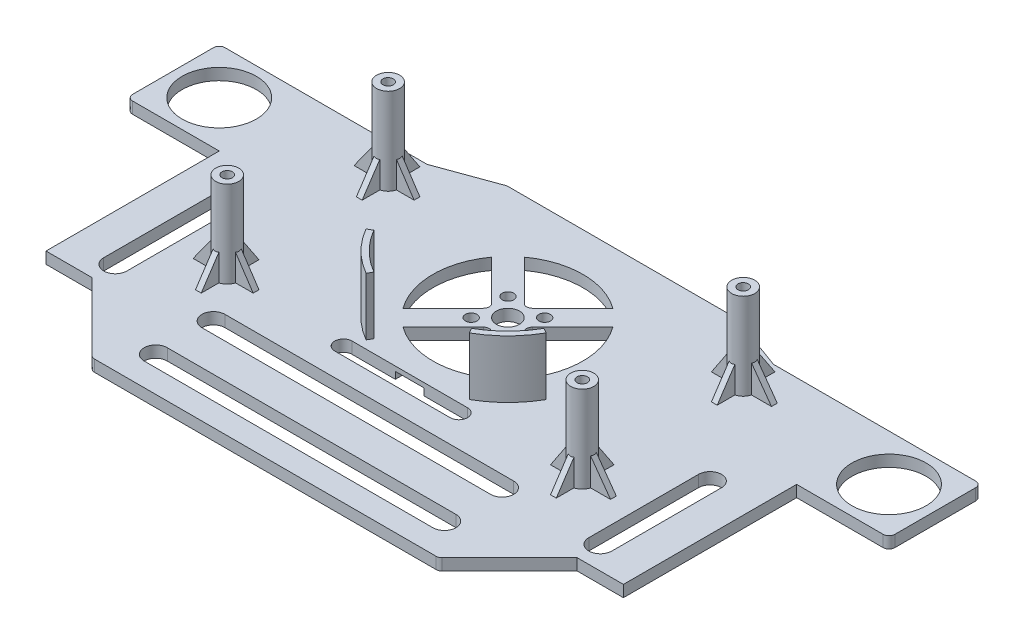
from build123d import *

# Parameters (mm, degrees)
SKETCH_1_R                                 = 6.425
SKETCH_1_R_2                               = 1
SKETCH_1_R_3                               = 2
EXTRUDE_1_DEPTH                            = 2
SKETCH_3_R                                 = 2
SKETCH_3_R_2                               = 0.9
EXTRUDE_6_DEPTH                            = 15
SKETCH_5_R                                 = 0.9
EXTRUDE_7_DEPTH                            = 6
SKETCH_7_W                                 = 5
SKETCH_7_H                                 = 4.242649178
CUT_EXTRUDE_2_DEPTH                        = 1.2
FILLET_1_R                                 = 1
RIB_1_REACH                                = 87.726
SKETCH_8_WALL_W                            = 182.694339246
SKETCH_8_WALL_H                            = 1
RIB_2_REACH                                = 87.726
SKETCH_10_WALL_W                           = 182.46649555
SKETCH_10_WALL_H                           = 1
RIB_3_REACH                                = 106.278
SKETCH_11_WALL_W                           = 219.569724544
SKETCH_11_WALL_H                           = 1
RIB_4_REACH                                = 106.278
SKETCH_12_WALL_W                           = 219.569724544
SKETCH_12_WALL_H                           = 1
MIRROR_1_AT_THE_SECOND_PLANE_COPY_1_REACH  = 87.726
MIRROR_1_AT_THE_SECOND_PLANE_COPY_1_SKET_W = 182.694339246
MIRROR_1_AT_THE_SECOND_PLANE_COPY_1_SKET_H = 1
MIRROR_1_AT_THE_SECOND_PLANE_COPY_2_REACH  = 87.726
MIRROR_1_AT_THE_SECOND_PLANE_COPY_2_SKET_W = 182.46649555
MIRROR_1_AT_THE_SECOND_PLANE_COPY_2_SKET_H = 1
MIRROR_1_AT_THE_SECOND_PLANE_COPY_3_REACH  = 106.278
MIRROR_1_AT_THE_SECOND_PLANE_COPY_3_SKET_W = 219.569724544
MIRROR_1_AT_THE_SECOND_PLANE_COPY_3_SKET_H = 1
MIRROR_1_AT_THE_SECOND_PLANE_COPY_4_REACH  = 106.278
MIRROR_1_AT_THE_SECOND_PLANE_COPY_4_SKET_W = 219.569724544
MIRROR_1_AT_THE_SECOND_PLANE_COPY_4_SKET_H = 1
CUT_EXTRUDE_START                          = -5
CUT_EXTRUDE_3_DEPTH                        = 5


with BuildPart() as part:
    # 草图1 → 凸台-拉伸1 (new body)
    with BuildSketch(Plane(origin=(0, 0, 0), x_dir=(1, 0, 0), z_dir=(0, 1, 0))):
        Polygon((-66, 23), (-66, 7), (-50, 7), (-50, -23), (-42, -23), (-30, -35), (30, -35), (42, -23), (50, -23), (50, 7), (66, 7), (66, 23), (30, 23), (19.848034865, 26.695013128), (-19.848034865, 26.695013128), (-30, 23), align=None)
        with BuildLine():
            ThreePointArc((-25, -31), (-27, -29), (-25, -27))
            Line((-25, -27), (25, -27))
            ThreePointArc((25, -27), (27, -29), (25, -31))
            Line((25, -31), (-25, -31))
        make_face(mode=Mode.SUBTRACT)
        with BuildLine():
            ThreePointArc((-25, -21), (-27, -19), (-25, -17))
            Line((-25, -17), (25, -17))
            ThreePointArc((25, -17), (27, -19), (25, -21))
            Line((25, -21), (-25, -21))
        make_face(mode=Mode.SUBTRACT)
        with BuildLine():
            ThreePointArc((-40, -19), (-42, -21), (-44, -19))
            Line((-44, -19), (-44, 0))
            ThreePointArc((-44, 0), (-42, 2), (-40, 0))
            Line((-40, 0), (-40, -19))
        make_face(mode=Mode.SUBTRACT)
        with BuildLine():
            ThreePointArc((-10, -13), (-11.5, -11.5), (-10, -10))
            Line((-10, -10), (10, -10))
            ThreePointArc((10, -10), (11.5, -11.5), (10, -13))
            Line((10, -13), (-10, -13))
        make_face(mode=Mode.SUBTRACT)
        with BuildLine():
            Line((44, 0), (44, -19))
            ThreePointArc((44, -19), (42, -21), (40, -19))
            Line((40, -19), (40, 0))
            ThreePointArc((40, 0), (42, 2), (44, 0))
        make_face(mode=Mode.SUBTRACT)
        with Locations(Location((-58, 15, 0), (0, 0, 270))):
            Circle(SKETCH_1_R, mode=Mode.SUBTRACT)
        with Locations(Location((58, 15, 0), (0, 0, 270))):
            Circle(SKETCH_1_R, mode=Mode.SUBTRACT)
        with BuildLine():
            Line((10.497164625, -0.6687375), (3.535533906, 6.292893219))
            ThreePointArc((3.535533906, 6.292893219), (3.242640687, 7), (3.535533906, 7.707106781))
            Line((3.535533906, 7.707106781), (10.497164625, 14.6687375))
            ThreePointArc((10.497164625, 14.6687375), (13, 7), (10.497164625, -0.6687375))
        make_face(mode=Mode.SUBTRACT)
        with BuildLine():
            ThreePointArc((-7.6687375, 17.497164625), (0, 20), (7.6687375, 17.497164625))
            Line((7.6687375, 17.497164625), (0.707106781, 10.535533906))
            ThreePointArc((0.707106781, 10.535533906), (0, 10.242640687), (-0.707106781, 10.535533906))
            Line((-0.707106781, 10.535533906), (-7.6687375, 17.497164625))
        make_face(mode=Mode.SUBTRACT)
        with BuildLine():
            ThreePointArc((-10.497164625, -0.6687375), (-13, 7), (-10.497164625, 14.6687375))
            Line((-10.497164625, 14.6687375), (-3.535533906, 7.707106781))
            ThreePointArc((-3.535533906, 7.707106781), (-3.242640687, 7), (-3.535533906, 6.292893219))
            Line((-3.535533906, 6.292893219), (-10.497164625, -0.6687375))
        make_face(mode=Mode.SUBTRACT)
        with BuildLine():
            ThreePointArc((7.6687375, -3.497164625), (0, -6), (-7.6687375, -3.497164625))
            Line((-7.6687375, -3.497164625), (-0.707106781, 3.464466094))
            ThreePointArc((-0.707106781, 3.464466094), (0, 3.757359313), (0.707106781, 3.464466094))
            Line((0.707106781, 3.464466094), (7.6687375, -3.497164625))
        make_face(mode=Mode.SUBTRACT)
        with Locations(Location((3.181980515, 10.181980515, 0), (0, 0, 270))):
            Circle(SKETCH_1_R_2, mode=Mode.SUBTRACT)
        with Locations(Location((-3.181980515, 10.181980515, 0), (0, 0, 270))):
            Circle(SKETCH_1_R_2, mode=Mode.SUBTRACT)
        with Locations(Location((3.181980515, 3.818019485, 0), (0, 0, 270))):
            Circle(SKETCH_1_R_2, mode=Mode.SUBTRACT)
        with Locations(Location((0, 7, 0), (0, 0, 270))):
            Circle(SKETCH_1_R_3, mode=Mode.SUBTRACT)
        with Locations(Location((-3.181980515, 3.818019485, 0), (0, 0, 270))):
            Circle(SKETCH_1_R_2, mode=Mode.SUBTRACT)
    extrude(amount=EXTRUDE_1_DEPTH)

    # 草图3 → 凸台-拉伸6 (add)
    # profile 1 of 6: a face of its own
    with BuildSketch(Plane(origin=(0, 2, 0), x_dir=(1, 0, 0), z_dir=(0, 1, 0))):
        with Locations(Location((-30.7465, -10.87, 0), (0, 0, 90))):
            Circle(SKETCH_3_R)
        with Locations(Location((-30.7465, -10.87, 0), (0, 0, 90))):
            Circle(SKETCH_3_R_2, mode=Mode.SUBTRACT)
    # profile 2 of 6: a face of its own
    with BuildSketch(Plane(origin=(0, 2, 0), x_dir=(1, 0, 0), z_dir=(0, 1, 0))):
        with Locations(Location((-30.7465, 17, 0), (0, 0, 90))):
            Circle(SKETCH_3_R)
        with Locations(Location((-30.7465, 17, 0), (0, 0, 90))):
            Circle(SKETCH_3_R_2, mode=Mode.SUBTRACT)
    # profile 3 of 6: a face of its own
    with BuildSketch(Plane(origin=(0, 2, 0), x_dir=(1, 0, 0), z_dir=(0, 1, 0))):
        with Locations(Location((30.7465, -10.87, 0), (0, 0, 270))):
            Circle(SKETCH_3_R)
        with Locations(Location((30.7465, -10.87, 0), (0, 0, 270))):
            Circle(SKETCH_3_R_2, mode=Mode.SUBTRACT)
    # profile 4 of 6: a face of its own
    with BuildSketch(Plane(origin=(0, 2, 0), x_dir=(1, 0, 0), z_dir=(0, 1, 0))):
        with Locations(Location((30.7465, 17, 0), (0, 0, 270))):
            Circle(SKETCH_3_R)
        with Locations(Location((30.7465, 17, 0), (0, 0, 270))):
            Circle(SKETCH_3_R_2, mode=Mode.SUBTRACT)
    # profile 5 of 6: a face of its own
    with BuildSketch(Plane(origin=(0, 2, 0), x_dir=(1, 0, 0), z_dir=(0, 1, 0))):
        with BuildLine():
            Line((-15.599915554, -1.980124426), (-14.733253579, -1.481228625))
            ThreePointArc((-14.733253579, -1.481228625), (-13.49359917, -3.34034726), (-12.02081528, -5.02081528))
            ThreePointArc((-12.02081528, -5.02081528), (-10.326099068, -6.504505842), (-8.450107982, -7.751124537))
            Line((-8.450107982, -7.751124537), (-8.947173157, -8.618837745))
            ThreePointArc((-8.947173157, -8.618837745), (-10.93351666, -7.298888539), (-12.727922061, -5.727922061))
            ThreePointArc((-12.727922061, -5.727922061), (-14.287340297, -3.948602981), (-15.599915554, -1.980124426))
        make_face()
    # profile 6 of 6: a face of its own
    with BuildSketch(Plane(origin=(0, 2, 0), x_dir=(1, 0, 0), z_dir=(0, 1, 0))):
        with BuildLine():
            Line((8.450107982, -7.751124537), (8.947173157, -8.618837745))
            ThreePointArc((8.947173157, -8.618837745), (10.93351666, -7.298888539), (12.727922061, -5.727922061))
            ThreePointArc((12.727922061, -5.727922061), (14.287340297, -3.948602981), (15.599915554, -1.980124426))
            Line((15.599915554, -1.980124426), (14.733253579, -1.481228625))
            ThreePointArc((14.733253579, -1.481228625), (13.49359917, -3.34034726), (12.02081528, -5.02081528))
            ThreePointArc((12.02081528, -5.02081528), (10.326099068, -6.504505842), (8.450107982, -7.751124537))
        make_face()
    extrude(amount=EXTRUDE_6_DEPTH)

    # 草图5 → 凸台-拉伸7 (add)
    with BuildSketch(Plane(origin=(0, 2, 0), x_dir=(1, 0, 0), z_dir=(0, 1, 0))):
        with Locations(Location((30.7465, 17, 0), (0, 0, 270))):
            Circle(SKETCH_5_R)
        with Locations(Location((30.7465, -10.87, 0), (0, 0, 270))):
            Circle(SKETCH_5_R)
        with Locations(Location((-30.7465, -10.87, 0), (0, 0, 90))):
            Circle(SKETCH_5_R)
        with Locations(Location((-30.7465, 17, 0), (0, 0, 90))):
            Circle(SKETCH_5_R)
    extrude(amount=EXTRUDE_7_DEPTH)

    # 草图7 → 切除-拉伸2 (cut)
    with BuildSketch(Plane.XZ):
        with Locations((0, 7.878675411)):
            Rectangle(SKETCH_7_W, SKETCH_7_H)
    extrude(amount=-CUT_EXTRUDE_2_DEPTH, mode=Mode.SUBTRACT)

    # 圆角1
    fillet_1_edges = [part.edges().sort_by_distance(p)[0] for p in [
        (66, 1, -23),
        (66, 1, -7),
        (30, 1, 35),
        (-30, 1, 35),
        (-66, 1, -7),
        (-66, 1, -23),
        (-19.848034865, 1, -26.695013128),
        (19.848034865, 1, -26.695013128),
    ]]
    fillet(fillet_1_edges, radius=FILLET_1_R)

    # 草图8 wall → 筋1 (add, up to next)
    with BuildSketch(Plane(origin=(-33.446473305, 5.75, -17), x_dir=(-0.584300921064, -0.81153708088, 0), z_dir=(0.81153708088, -0.584300921064, 0)), mode=Mode.PRIVATE) as rib_1_sk1:
        Rectangle(SKETCH_8_WALL_W, SKETCH_8_WALL_H)
    rib_1_tool1 = extrude(rib_1_sk1.sketch, amount=RIB_1_REACH, mode=Mode.PRIVATE) - part.part
    rib_1 = rib_1_tool1.solids().sort_by_distance((-33.446473305, 5.75, -17))[0]
    add(rib_1)

    # 草图10 wall → 筋2 (add, up to next)
    with BuildSketch(Plane(origin=(-28.2465, 5.75, -17), x_dir=(0.554700196225, -0.832050294338, 0), z_dir=(0.832050294338, 0.554700196225, 0)), mode=Mode.PRIVATE) as rib_2_sk1:
        Rectangle(SKETCH_10_WALL_W, SKETCH_10_WALL_H)
    rib_2_tool1 = extrude(rib_2_sk1.sketch, amount=-RIB_2_REACH, mode=Mode.PRIVATE) - part.part
    rib_2 = rib_2_tool1.solids().sort_by_distance((-28.2465, 5.75, -17))[0]
    add(rib_2)

    # 草图11 wall → 筋3 (add, up to next)
    with BuildSketch(Plane(origin=(-30.7465, 5.75, -19.5), x_dir=(0, -0.832050294338, -0.554700196225), z_dir=(0, -0.554700196225, 0.832050294338)), mode=Mode.PRIVATE) as rib_3_sk1:
        Rectangle(SKETCH_11_WALL_W, SKETCH_11_WALL_H)
    rib_3_tool1 = extrude(rib_3_sk1.sketch, amount=RIB_3_REACH, mode=Mode.PRIVATE) - part.part
    rib_3 = rib_3_tool1.solids().sort_by_distance((-30.7465, 5.75, -19.5))[0]
    add(rib_3)

    # 草图12 wall → 筋4 (add, up to next)
    with BuildSketch(Plane(origin=(-30.7465, 5.75, -14.5), x_dir=(0, -0.832050294338, 0.554700196225), z_dir=(0, 0.554700196225, 0.832050294338)), mode=Mode.PRIVATE) as rib_4_sk1:
        Rectangle(SKETCH_12_WALL_W, SKETCH_12_WALL_H)
    rib_4_tool1 = extrude(rib_4_sk1.sketch, amount=-RIB_4_REACH, mode=Mode.PRIVATE) - part.part
    rib_4 = rib_4_tool1.solids().sort_by_distance((-30.7465, 5.75, -14.5))[0]
    add(rib_4)

    # 镜向1: 筋1, 筋2, 筋3, 筋4 across plane
    add(rib_1.mirror(Plane.ZY))
    add(rib_2.mirror(Plane.ZY))
    add(rib_3.mirror(Plane.ZY))
    add(rib_4.mirror(Plane.ZY))

    # 镜向1 at the second plane: 筋1, 筋2, 筋3, 筋4 across plane
    add(rib_1.mirror(Plane.XY.offset(-3.065)))
    add(rib_2.mirror(Plane.XY.offset(-3.065)))
    add(rib_3.mirror(Plane.XY.offset(-3.065)))
    add(rib_4.mirror(Plane.XY.offset(-3.065)))

    # 镜向1 at the second plane copy 1 sket → 镜向1 at the second plane copy 1 (add, up to next)
    with BuildSketch(Plane(origin=(33.446473305, 5.75, 10.87), x_dir=(0.584300921064, -0.81153708088, 0), z_dir=(-0.81153708088, -0.584300921064, 0)), mode=Mode.PRIVATE) as mirror_1_at_the_second_plane_copy_1_sk1:
        Rectangle(MIRROR_1_AT_THE_SECOND_PLANE_COPY_1_SKET_W, MIRROR_1_AT_THE_SECOND_PLANE_COPY_1_SKET_H)
    mirror_1_at_the_second_plane_copy_1_tool1 = extrude(mirror_1_at_the_second_plane_copy_1_sk1.sketch, amount=MIRROR_1_AT_THE_SECOND_PLANE_COPY_1_REACH, mode=Mode.PRIVATE) - part.part
    add(mirror_1_at_the_second_plane_copy_1_tool1.solids().sort_by_distance((33.446473305, 5.75, 10.87))[0])

    # 镜向1 at the second plane copy 2 sket → 镜向1 at the second plane copy 2 (add, up to next)
    with BuildSketch(Plane(origin=(28.2465, 5.75, 10.87), x_dir=(-0.554700196225, -0.832050294338, 0), z_dir=(-0.832050294338, 0.554700196225, 0)), mode=Mode.PRIVATE) as mirror_1_at_the_second_plane_copy_2_sk1:
        Rectangle(MIRROR_1_AT_THE_SECOND_PLANE_COPY_2_SKET_W, MIRROR_1_AT_THE_SECOND_PLANE_COPY_2_SKET_H)
    mirror_1_at_the_second_plane_copy_2_tool1 = extrude(mirror_1_at_the_second_plane_copy_2_sk1.sketch, amount=-MIRROR_1_AT_THE_SECOND_PLANE_COPY_2_REACH, mode=Mode.PRIVATE) - part.part
    add(mirror_1_at_the_second_plane_copy_2_tool1.solids().sort_by_distance((28.2465, 5.75, 10.87))[0])

    # 镜向1 at the second plane copy 3 sket → 镜向1 at the second plane copy 3 (add, up to next)
    with BuildSketch(Plane(origin=(30.7465, 5.75, 13.37), x_dir=(0, -0.832050294338, 0.554700196225), z_dir=(0, -0.554700196225, -0.832050294338)), mode=Mode.PRIVATE) as mirror_1_at_the_second_plane_copy_3_sk1:
        Rectangle(MIRROR_1_AT_THE_SECOND_PLANE_COPY_3_SKET_W, MIRROR_1_AT_THE_SECOND_PLANE_COPY_3_SKET_H)
    mirror_1_at_the_second_plane_copy_3_tool1 = extrude(mirror_1_at_the_second_plane_copy_3_sk1.sketch, amount=MIRROR_1_AT_THE_SECOND_PLANE_COPY_3_REACH, mode=Mode.PRIVATE) - part.part
    add(mirror_1_at_the_second_plane_copy_3_tool1.solids().sort_by_distance((30.7465, 5.75, 13.37))[0])

    # 镜向1 at the second plane copy 4 sket → 镜向1 at the second plane copy 4 (add, up to next)
    with BuildSketch(Plane(origin=(30.7465, 5.75, 8.37), x_dir=(0, -0.832050294338, -0.554700196225), z_dir=(0, 0.554700196225, -0.832050294338)), mode=Mode.PRIVATE) as mirror_1_at_the_second_plane_copy_4_sk1:
        Rectangle(MIRROR_1_AT_THE_SECOND_PLANE_COPY_4_SKET_W, MIRROR_1_AT_THE_SECOND_PLANE_COPY_4_SKET_H)
    mirror_1_at_the_second_plane_copy_4_tool1 = extrude(mirror_1_at_the_second_plane_copy_4_sk1.sketch, amount=-MIRROR_1_AT_THE_SECOND_PLANE_COPY_4_REACH, mode=Mode.PRIVATE) - part.part
    add(mirror_1_at_the_second_plane_copy_4_tool1.solids().sort_by_distance((30.7465, 5.75, 8.37))[0])

    # 草图16 → 切除-拉伸3 (cut)
    with BuildSketch(Plane(origin=(0, 17, 0), x_dir=(1, 0, 0), z_dir=(0, 1, 0)).offset(CUT_EXTRUDE_START)):
        with BuildLine():
            Line((8.450107982, -7.751124537), (8.947173157, -8.618837745))
            ThreePointArc((8.947173157, -8.618837745), (12.714480708, -5.741349235), (15.599915554, -1.980124426))
            Line((15.599915554, -1.980124426), (14.733253579, -1.481228625))
            ThreePointArc((14.733253579, -1.481228625), (12.008120669, -5.033496499), (8.450107982, -7.751124537))
        make_face()
        with BuildLine():
            Line((-8.947173157, -8.618837745), (-8.450107982, -7.751124537))
            ThreePointArc((-8.450107982, -7.751124537), (-12.008120669, -5.033496499), (-14.733253579, -1.481228625))
            Line((-14.733253579, -1.481228625), (-15.599915554, -1.980124426))
            ThreePointArc((-15.599915554, -1.980124426), (-12.714480708, -5.741349235), (-8.947173157, -8.618837745))
        make_face()
    extrude(amount=CUT_EXTRUDE_3_DEPTH, mode=Mode.SUBTRACT)


solid = part.part
